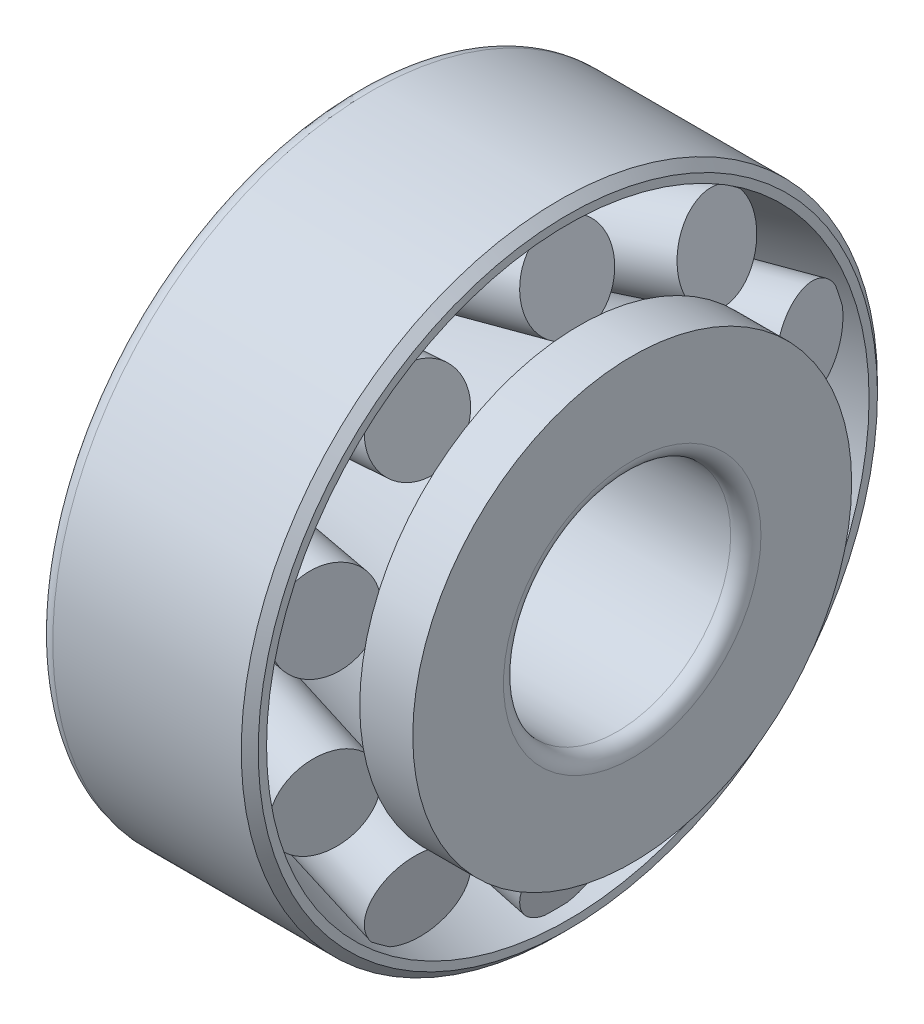
from build123d import *

# Parameters (mm, degrees)
ROLLERSDETAILED_COUNT = 10
ROLLERSDETAILED_ANGLE = 324


with BuildPart() as part:
    # OutRacSke → OuterRace (revolve)
    with BuildSketch(Plane.XY, mode=Mode.PRIVATE) as outerrace_sk:
        with BuildLine():
            Line((-4.25, 19.887288694), (-18.25, 16.136))
            Line((-18.25, 16.136), (-18.25, 20))
            ThreePointArc((-18.25, 20), (-17.957106781, 20.707106781), (-17.25, 21))
            Line((-17.25, 21), (-4.81, 21))
            Line((-4.81, 21), (-4.25, 20.44))
            Line((-4.25, 20.44), (-4.25, 19.887288694))
        make_face()
    revolve(outerrace_sk.sketch.rotate(Axis((-42.5, 0, 0), (1, 0, 0)), 270), axis=Axis((-42.5, 0, 0), (1, 0, 0)))

    # RolDetSke → RollerDetailed (revolve)
    with BuildSketch(Plane.XY):
        Polygon((-16.463837151, 13.551969241), (-17.25, 16.485968938), (-5.079334589, 19.747088906), (-4.293171739, 16.813089209), align=None)
    rollerdetailed = revolve(axis=Axis((-37.350248823, 7.9554721, 0), (0.9659258262890701, 0.25881904510251397, 0)))

    # RollersDetailed: RollerDetailed ×10 about axis
    rollersdetailed_axis = Axis((-50, 0, 0), (1, 0, 0))
    for i in range(1, ROLLERSDETAILED_COUNT):
        add(rollerdetailed.rotate(rollersdetailed_axis, i * ROLLERSDETAILED_ANGLE / (ROLLERSDETAILED_COUNT - 1)))

    # InsRacSke → InnerRace (revolve)
    with BuildSketch(Plane.XY, mode=Mode.PRIVATE) as innerrace_sk:
        with BuildLine():
            Line((-15.751202241, 10.921719543), (-17, 10.921719543))
            Line((-17, 10.921719543), (-17, 8.06))
            Line((-17, 8.06), (-16.44, 7.5))
            Line((-16.44, 7.5), (-1, 7.5))
            ThreePointArc((-1, 7.5), (-0.292893219, 7.792893219), (0, 8.5))
            Line((0, 8.5), (0, 14.486589511))
            Line((0, 14.486589511), (-3.499147263, 14.486589511))
            Line((-3.499147263, 14.486589511), (-3.499147263, 13.879089511))
            Line((-3.499147263, 13.879089511), (-15.669812674, 10.617969543))
            Line((-15.669812674, 10.617969543), (-15.751202241, 10.921719543))
        make_face()
    revolve(innerrace_sk.sketch.rotate(Axis((-42.5, 0, 0), (1, 0, 0)), 270), axis=Axis((-42.5, 0, 0), (1, 0, 0)))


solid = part.part
